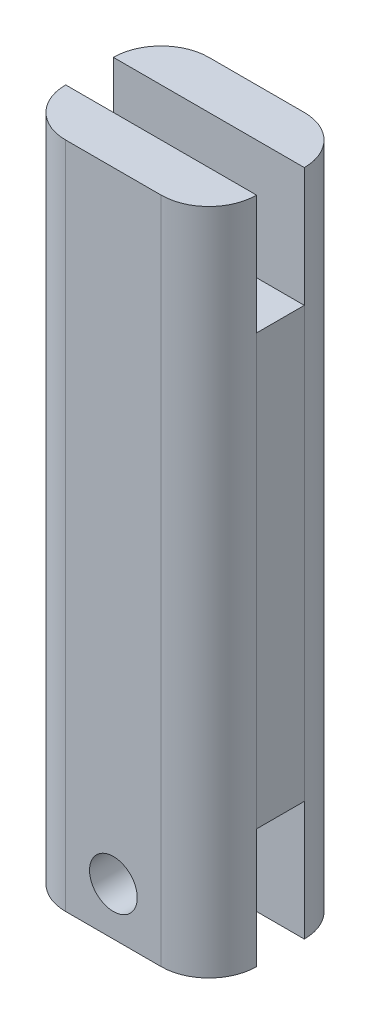
from build123d import *

# Parameters (mm, degrees)
SKETCH1_W               = 10.16
SKETCH1_H               = 7.62
BOSS_EXTRUDE1_DEPTH     = 35.56
FILLET1_R               = 2.54
SKETCH2_W               = 10.16
SKETCH2_H               = 2.54
CUT_EXTRUDE1_DEPTH      = 6.35
CUT_EXTRUDE2_DEPTH      = 38.759814618
CUT_EXTRUDE2_DEPTH_BACK = 38.759814618
SKETCH3_R               = 1.27


with BuildPart() as part:
    # Sketch1 → Boss-Extrude1 (new body)
    with BuildSketch(Plane(origin=(0, 0, 0), x_dir=(1, 0, 0), z_dir=(0, 1, 0))):
        with Locations((5.08, 3.81)):
            Rectangle(SKETCH1_W, SKETCH1_H)
    extrude(amount=BOSS_EXTRUDE1_DEPTH)

    # Fillet1
    fillet1_edges = [part.edges().sort_by_distance(p)[0] for p in [
        (0, 17.78, -7.62),
        (10.16, 17.78, -7.62),
        (10.16, 17.78, 0),
        (0, 17.78, 0),
    ]]
    fillet(fillet1_edges, radius=FILLET1_R)

    # Sketch2 → Cut-Extrude1 (cut)
    with BuildSketch(Plane(origin=(0, 0, 0), x_dir=(1, 0, 0), z_dir=(0, 1, 0))):
        with Locations((5.08, 3.81)):
            Rectangle(SKETCH2_W, SKETCH2_H)
    cut_extrude1 = extrude(amount=CUT_EXTRUDE1_DEPTH, mode=Mode.SUBTRACT)

    # Mirror1: Cut-Extrude1 across plane
    add(cut_extrude1.mirror(Plane.ZX.offset(17.78)), mode=Mode.SUBTRACT)

    # Sketch3 → Cut-Extrude2 (cut, two sides: drawn at the far end of the back side and taken through both)
    with BuildSketch(Plane.XY.offset(-CUT_EXTRUDE2_DEPTH_BACK)):
        with Locations(Location((5.08, 2.54, 0), (0, 0, 180))):
            Circle(SKETCH3_R)
    extrude(amount=CUT_EXTRUDE2_DEPTH + CUT_EXTRUDE2_DEPTH_BACK, mode=Mode.SUBTRACT)


solid = part.part
